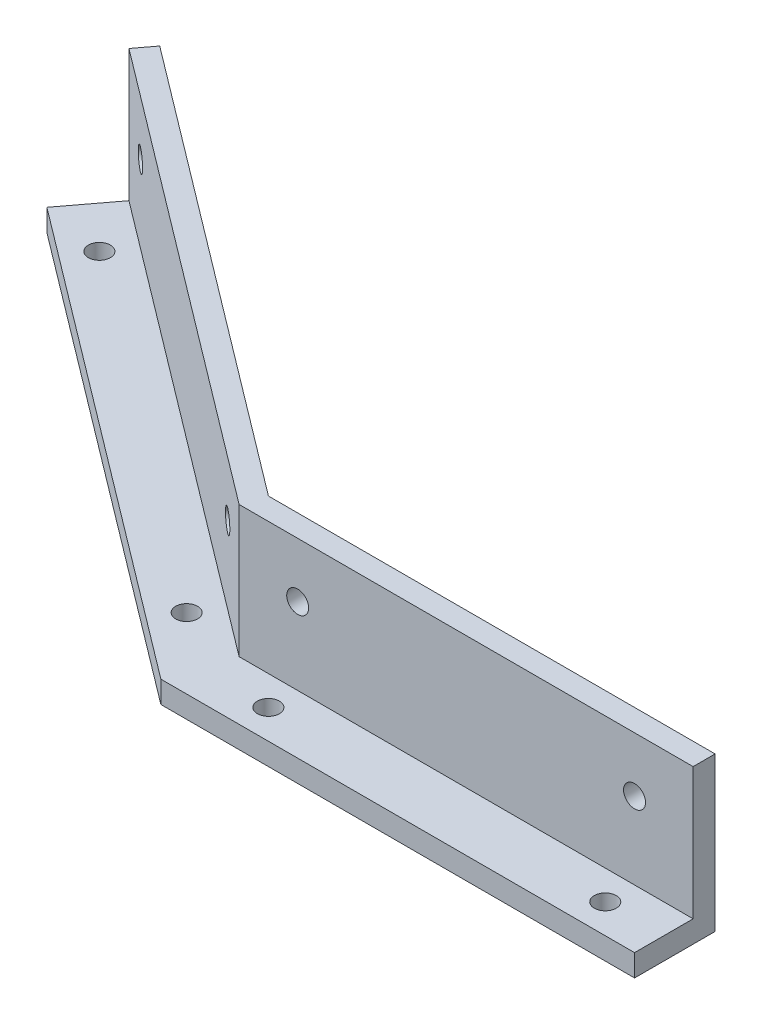
from build123d import *

# Parameters (mm, degrees)
SALIENTE_EXTRUIR4_DEPTH      = 3
SALIENTE_EXTRUIR6_DEPTH      = 18
SALIENTE_EXTRUIR6_DEPTH_BACK = 3
CROQUIS5_R                   = 1.5
CORTAR_EXTRUIR2_DEPTH        = 3
CROQUIS6_R                   = 1.5
CORTAR_EXTRUIR3_DEPTH        = 3
CROQUIS7_R                   = 1.5
CORTAR_EXTRUIR5_DEPTH        = 3
CROQUIS8_R                   = 1.5
CORTAR_EXTRUIR6_DEPTH        = 3
CROQUIS9_R                   = 1.5
CORTAR_EXTRUIR7_DEPTH        = 3
CROQUIS10_R                  = 1.5
SALIENTE_EXTRUIR7_DEPTH      = 3


with BuildPart() as part:
    # Croquis1 → Saliente-Extruir4 (new body)
    with BuildSketch(Plane(origin=(0, 0, 0), x_dir=(1, 0, 0), z_dir=(0, 1, 0))):
        Polygon((0, 0), (-62, 0), (-123.446373684, 46.404128707), (-128.267581862, 40.020089883), (-64.681421115, -8), (0, -8), align=None)
    extrude(amount=SALIENTE_EXTRUIR4_DEPTH)

    # Croquis4 → Saliente-Extruir6 (add, two sides: drawn at the far end of the back side and taken through both)
    with BuildSketch(Plane(origin=(0, 3, 0), x_dir=(1, 0, 0), z_dir=(0, 1, 0)).offset(-SALIENTE_EXTRUIR6_DEPTH_BACK)):
        Polygon((-123.446373684, 46.404128707), (-121.638420618, 48.798143266), (-60.994467082, 3), (0, 3), (0, 0), (-62, 0), align=None)
    extrude(amount=SALIENTE_EXTRUIR6_DEPTH + SALIENTE_EXTRUIR6_DEPTH_BACK)

    # Croquis5 → Cortar-Extruir2 (cut)
    with BuildSketch(Plane(origin=(0, 3, 0), x_dir=(1, 0, 0), z_dir=(0, 1, 0))):
        with Locations(Location((-4, -4, 0), (0, 0, 270))):
            Circle(CROQUIS5_R)
        with Locations(Location((-58, -4, 0), (0, 0, 270))):
            Circle(CROQUIS5_R)
    extrude(amount=-CORTAR_EXTRUIR2_DEPTH, mode=Mode.SUBTRACT)

    # Croquis6 → Cortar-Extruir3 (cut)
    with BuildSketch(Plane(origin=(0, 3, 0), x_dir=(1, 0, 0), z_dir=(0, 1, 0))):
        with Locations(Location((-122.664958361, 40.801505206, 0), (0, 0, 270))):
            Circle(CROQUIS6_R)
        with Locations(Location((-67.602623501, -0.781415324, 0), (0, 0, 270))):
            Circle(CROQUIS6_R)
    extrude(amount=-CORTAR_EXTRUIR3_DEPTH, mode=Mode.SUBTRACT)

    # Croquis7 → Cortar-Extruir5 (cut)
    with BuildSketch(Plane(origin=(-22.51767178, 0, 29.816943304), x_dir=(0.7980048530430802, 0, 0.6026510221676322), z_dir=(-0.6026510221676322, 0, 0.7980048530430802))):
        with Locations((-118.476300889, 13.5)):
            Circle(CROQUIS7_R)
        with Locations((-57.476300889, 13.5)):
            Circle(CROQUIS7_R)
    extrude(amount=-CORTAR_EXTRUIR5_DEPTH, mode=Mode.SUBTRACT)

    # Croquis8 → Cortar-Extruir6 (cut)
    with BuildSketch(Plane.XY):
        with Locations((-54, 13.5)):
            Circle(CROQUIS8_R)
        with Locations((-8, 13.5)):
            Circle(CROQUIS8_R)
    extrude(amount=-CORTAR_EXTRUIR6_DEPTH, mode=Mode.SUBTRACT)

    # Croquis9 → Cortar-Extruir7 (cut)
    with BuildSketch(Plane(origin=(0, 3, 0), x_dir=(1, 0, 0), z_dir=(0, 1, 0))):
        with Locations(Location((-119.472938949, 38.390901117, 0), (0, 0, 270))):
            Circle(CROQUIS9_R)
        with Locations(Location((-70.794642913, 1.629188765, 0), (0, 0, 270))):
            Circle(CROQUIS9_R)
        with Locations(Location((-54, -4, 0), (0, 0, 270))):
            Circle(CROQUIS9_R)
        with Locations(Location((-8, -4, 0), (0, 0, 270))):
            Circle(CROQUIS9_R)
    extrude(amount=-CORTAR_EXTRUIR7_DEPTH, mode=Mode.SUBTRACT)

    # Croquis10 → Saliente-Extruir7 (add)
    with BuildSketch(Plane(origin=(0, 3, 0), x_dir=(1, 0, 0), z_dir=(0, 1, 0))):
        with Locations((-58, -4)):
            Circle(CROQUIS10_R)
        with Locations((-4, -4)):
            Circle(CROQUIS10_R)
        with Locations((-67.602623501, -0.781415324)):
            Circle(CROQUIS10_R)
        with Locations((-122.664958361, 40.801505206)):
            Circle(CROQUIS10_R)
    extrude(amount=-SALIENTE_EXTRUIR7_DEPTH)


solid = part.part
